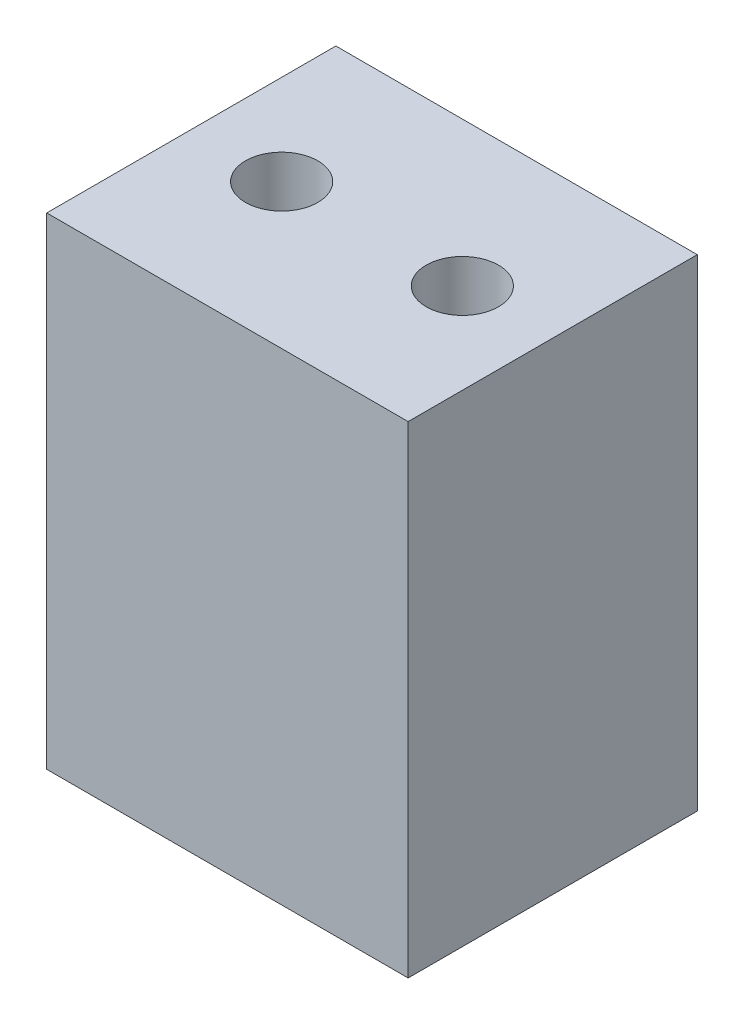
from build123d import *

# Parameters (mm, degrees)
SKETCH1_W           = 30
SKETCH1_H           = 24
BOSS_EXTRUDE1_DEPTH = 40
SKETCH2_R           = 3
CUT_EXTRUDE1_DEPTH  = 56.461698495


with BuildPart() as part:
    # Sketch1 → Boss-Extrude1 (new body)
    with BuildSketch(Plane(origin=(0, 0, 0), x_dir=(1, 0, 0), z_dir=(0, 1, 0))):
        with Locations((15, 12)):
            Rectangle(SKETCH1_W, SKETCH1_H)
    extrude(amount=BOSS_EXTRUDE1_DEPTH)

    # Sketch2 → Cut-Extrude1 (cut, through all)
    with BuildSketch(Plane(origin=(0, 40, 0), x_dir=(1, 0, 0), z_dir=(0, 1, 0))):
        with Locations(Location((7.5, 12, 0), (0, 0, 270))):
            Circle(SKETCH2_R)
        with Locations(Location((22.5, 12, 0), (0, 0, 270))):
            Circle(SKETCH2_R)
    extrude(amount=-CUT_EXTRUDE1_DEPTH, mode=Mode.SUBTRACT)


solid = part.part
